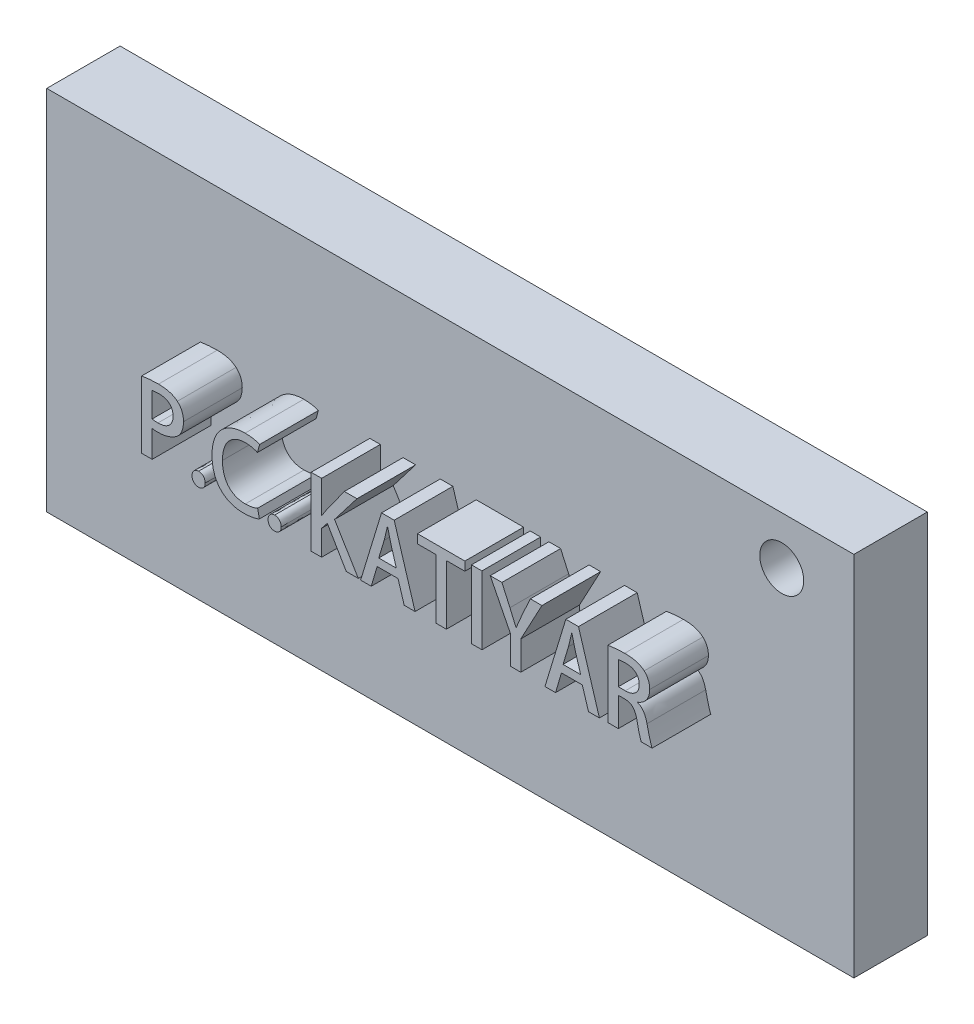
from build123d import *

# Parameters (mm, degrees)
SKETCH1_W           = 55
SKETCH1_H           = 25
BOSS_EXTRUDE1_DEPTH = 5
SKETCH3_W           = 0.714515982
SKETCH3_H           = 4.656666667
BOSS_EXTRUDE4_DEPTH = 4
SKETCH6_R           = 1.5
CUT_EXTRUDE1_DEPTH  = 7


with BuildPart() as part:
    # Sketch1 → Boss-Extrude1 (new body)
    with BuildSketch(Plane.XY):
        Rectangle(SKETCH1_W, SKETCH1_H)
    extrude(amount=BOSS_EXTRUDE1_DEPTH)

    # Sketch3 → Boss-Extrude4 (add)
    # profile 1 of 11: a face of its own
    with BuildSketch(Plane.XY.offset(5)):
        with BuildLine():
            Line((-17.029770283, -1.800414913), (-16.315254301, -1.800414913))
            Line((-16.315254301, -1.800414913), (-16.315254301, 0.023936519))
            add(Edge.make_bspline(
                [(-16.315254301, 0.023936519), (-16.285392815, 0.018639375), (-16.223879003, 0.007727408), (-16.127983148, -0.001163949), (-16.026409437, -0.006734384), (-15.956832168, -0.006633939), (-15.92103906, -0.006582267)],
                knots=[0, 0, 0, 0, 0.918571729, 1.892231672, 2.915686383, 4, 4, 4, 4], degree=3))
            add(Edge.make_bspline(
                [(-15.92103906, -0.006582267), (-15.866743001, -0.006552611), (-15.759417019, -0.006493991), (-15.600654275, 0.00838968), (-15.445883638, 0.032684173), (-15.295180159, 0.068728451), (-15.148615385, 0.116740488), (-15.00587218, 0.174712233), (-14.86725815, 0.243691045), (-14.733599907, 0.322766035), (-14.60882504, 0.415295917), (-14.498440162, 0.524531899), (-14.40492606, 0.649747113), (-14.32675556, 0.789759899), (-14.264511341, 0.944457167), (-14.218028562, 1.114204168), (-14.187055863, 1.298806239), (-14.17983852, 1.427312507), (-14.176108655, 1.493723503)],
                knots=[0, 0, 0, 0, 1.002223409, 1.981075816, 2.941057117, 3.893567037, 4.839120738, 5.786658294, 6.736252809, 7.695867274, 8.651375827, 9.597441389, 10.552949943, 11.527852714, 12.550822771, 13.624507394, 14.772364707, 16, 16, 16, 16], degree=3))
            add(Edge.make_bspline(
                [(-14.176108655, 1.493723503), (-14.1783963, 1.54571858), (-14.182862192, 1.647222294), (-14.20512132, 1.79455995), (-14.239374517, 1.93282038), (-14.285851746, 2.062359991), (-14.3460668, 2.182243262), (-14.417887871, 2.293527018), (-14.502339657, 2.395656094), (-14.56807978, 2.454809629), (-14.601121961, 2.484541272)],
                knots=[0, 0, 0, 0, 1.121960372, 2.190267843, 3.207584746, 4.190239261, 5.152208329, 6.094546313, 7.042284316, 8, 8, 8, 8], degree=3))
            add(Edge.make_bspline(
                [(-14.601121961, 2.484541272), (-14.638282312, 2.514526794), (-14.713772144, 2.575441239), (-14.842300797, 2.650812914), (-14.983447027, 2.714750069), (-15.137715933, 2.767890995), (-15.305708989, 2.808121189), (-15.487121676, 2.835074112), (-15.681602848, 2.853664121), (-15.815691527, 2.855123855), (-15.884961326, 2.855877949)],
                knots=[0, 0, 0, 0, 0.838628006, 1.70364077, 2.610636308, 3.559859354, 4.568055018, 5.643200099, 6.782484425, 8, 8, 8, 8], degree=3))
            add(Edge.make_bspline(
                [(-15.884961326, 2.855877949), (-15.943333683, 2.854829794), (-16.057161841, 2.852785856), (-16.223213823, 2.847720828), (-16.380179001, 2.839929349), (-16.527994713, 2.829119118), (-16.666832774, 2.817260546), (-16.796528172, 2.802275236), (-16.916835617, 2.7848931), (-16.993726229, 2.771023788), (-17.030649368, 2.764363697)],
                knots=[0, 0, 0, 0, 1.217605855, 2.374374404, 3.464660226, 4.494999595, 5.465333604, 6.370582827, 7.217548217, 8, 8, 8, 8], degree=3))
            Line((-17.030649368, 2.764363697), (-17.029770283, -1.800414913))
        make_face()
        with BuildLine():
            add(Edge.make_bspline(
                [(-16.315254301, 2.260822198), (-16.287740393, 2.266242775), (-16.225444409, 2.278515847), (-16.11894681, 2.28978789), (-15.988917885, 2.298409045), (-15.894071527, 2.300993532), (-15.842723979, 2.302392712)],
                knots=[0, 0, 0, 0, 0.7081459, 1.603358068, 2.702515415, 4, 4, 4, 4], degree=3))
            add(Edge.make_bspline(
                [(-15.842723979, 2.302392712), (-15.807799407, 2.301663325), (-15.739573213, 2.300238447), (-15.639808614, 2.290691735), (-15.54542675, 2.273891015), (-15.456276344, 2.251023722), (-15.372304007, 2.222427452), (-15.294087857, 2.185734236), (-15.221152695, 2.142914183), (-15.153999828, 2.09330162), (-15.09260626, 2.038093463), (-15.039769552, 1.975063555), (-14.994275989, 1.905792115), (-14.957461766, 1.829656531), (-14.928351051, 1.747300297), (-14.907337063, 1.658519729), (-14.894028355, 1.563337439), (-14.891779103, 1.497581044), (-14.890623778, 1.463805382)],
                knots=[0, 0, 0, 0, 1.16517395, 2.276202082, 3.339667925, 4.360262278, 5.344409501, 6.294443781, 7.237649562, 8.161467064, 9.075802852, 9.985465996, 10.897442204, 11.83402534, 12.799705885, 13.806079676, 14.873096483, 16, 16, 16, 16], degree=3))
            add(Edge.make_bspline(
                [(-14.890623778, 1.463805382), (-14.891804611, 1.427983886), (-14.894106598, 1.358151308), (-14.907119249, 1.25671211), (-14.929285884, 1.161883545), (-14.959234619, 1.073415289), (-14.996817491, 0.990952124), (-15.04403857, 0.915391587), (-15.099906969, 0.846577936), (-15.163425629, 0.783729672), (-15.234746969, 0.72839274), (-15.313289756, 0.680728184), (-15.3978016, 0.638984096), (-15.489647578, 0.605708611), (-15.588229024, 0.580638761), (-15.693068382, 0.560896462), (-15.804942769, 0.549750203), (-15.881711729, 0.547867463), (-15.92103906, 0.54690297)],
                knots=[0, 0, 0, 0, 1.098810706, 2.142087657, 3.130558938, 4.080710143, 5.002414742, 5.90351999, 6.805477983, 7.715119197, 8.638227497, 9.567016518, 10.528554789, 11.524610674, 12.556657526, 13.645294696, 14.7937276, 16, 16, 16, 16], degree=3))
            add(Edge.make_bspline(
                [(-15.92103906, 0.54690297), (-15.959475635, 0.546770606), (-16.032887214, 0.546517798), (-16.137149196, 0.552786407), (-16.230653249, 0.563087425), (-16.288070832, 0.576588723), (-16.315254301, 0.582980704)],
                knots=[0, 0, 0, 0, 1.161542367, 2.218477041, 3.156565424, 4, 4, 4, 4], degree=3))
            Line((-16.315254301, 0.582980704), (-16.315254301, 2.260822198))
        make_face(mode=Mode.SUBTRACT)
    # profile 2 of 11: a face of its own
    with BuildSketch(Plane.XY.offset(5)):
        with BuildLine():
            add(Edge.make_bspline(
                [(-13.155704463, -1.865905487), (-13.122534719, -1.864017984), (-13.059060567, -1.860406027), (-12.970000993, -1.833739906), (-12.890981162, -1.793350651), (-12.825927069, -1.734642907), (-12.772241754, -1.664855291), (-12.734283044, -1.583103764), (-12.711053717, -1.491715865), (-12.707542355, -1.427542114), (-12.705721007, -1.394255111)],
                knots=[0, 0, 0, 0, 1.086321549, 2.078802294, 3.02560671, 3.973192882, 4.927592108, 5.895903821, 6.908602731, 8, 8, 8, 8], degree=3))
            add(Edge.make_bspline(
                [(-12.705721007, -1.394255111), (-12.707430475, -1.360067406), (-12.710717526, -1.294329574), (-12.735225644, -1.201403443), (-12.773093001, -1.118466626), (-12.826477343, -1.047682222), (-12.891989322, -0.98944608), (-12.969426945, -0.947673006), (-13.056630024, -0.921317721), (-13.118222758, -0.917526759), (-13.150093097, -0.915565176)],
                knots=[0, 0, 0, 0, 1.119884095, 2.153369304, 3.130156156, 4.09200604, 5.039367142, 5.9820291, 6.955827887, 8, 8, 8, 8], degree=3))
            add(Edge.make_bspline(
                [(-13.150093097, -0.915565176), (-13.181661374, -0.917898254), (-13.24263235, -0.922404361), (-13.329699727, -0.94868924), (-13.407394138, -0.991512808), (-13.474629439, -1.050197595), (-13.529100913, -1.121596096), (-13.569619302, -1.203657558), (-13.594614201, -1.295750399), (-13.598574779, -1.36065834), (-13.6006248, -1.394255111)],
                knots=[0, 0, 0, 0, 1.034342518, 1.997729303, 2.952262481, 3.919234818, 4.899147778, 5.87438783, 6.899769402, 8, 8, 8, 8], degree=3))
            add(Edge.make_bspline(
                [(-13.6006248, -1.394255111), (-13.598699766, -1.426640017), (-13.594978249, -1.489247202), (-13.572965504, -1.578998633), (-13.535280444, -1.659478875), (-13.484191921, -1.730521313), (-13.419563724, -1.789519294), (-13.341807881, -1.832383059), (-13.252705328, -1.859413548), (-13.189302928, -1.863680975), (-13.155704463, -1.865905487)],
                knots=[0, 0, 0, 0, 1.071520527, 2.071486102, 3.03497588, 3.993569347, 4.948276975, 5.903723635, 6.907259185, 8, 8, 8, 8], degree=3))
        make_face()
    # profile 3 of 11: a face of its own
    with BuildSketch(Plane.XY.offset(5)):
        with BuildLine():
            add(Edge.make_bspline(
                [(-9.131938905, -1.093733361), (-9.159157803, -1.106034189), (-9.215301949, -1.131406983), (-9.305933693, -1.162626679), (-9.404263472, -1.190870151), (-9.547653614, -1.222221287), (-9.737451826, -1.251363711), (-9.892703174, -1.25625417), (-9.971732722, -1.258743622)],
                knots=[0, 0, 0, 0, 0.623452072, 1.285988292, 1.999456477, 2.758826813, 4.350104822, 6, 6, 6, 6], degree=3))
            add(Edge.make_bspline(
                [(-9.971732722, -1.258743622), (-10.030757036, -1.257152592), (-10.146000059, -1.254046159), (-10.314038601, -1.23187746), (-10.472063951, -1.195101249), (-10.620179439, -1.143872769), (-10.758390365, -1.078526848), (-10.886743354, -0.998765087), (-11.00571035, -0.905178637), (-11.112945256, -0.796013523), (-11.210210487, -0.674740787), (-11.294129837, -0.539533314), (-11.365529239, -0.392095512), (-11.423476868, -0.231529987), (-11.468982696, -0.058615258), (-11.501933268, 0.126780591), (-11.523650707, 0.324652519), (-11.526755923, 0.46090217), (-11.528354954, 0.531063965)],
                knots=[0, 0, 0, 0, 1.05357022, 2.05706105, 3.019831997, 3.945549259, 4.849673394, 5.743319306, 6.637992512, 7.545159443, 8.469260999, 9.40786221, 10.379774602, 11.388606811, 12.450446757, 13.567948197, 14.747614263, 16, 16, 16, 16], degree=3))
            add(Edge.make_bspline(
                [(-11.528354954, 0.531063965), (-11.526166632, 0.604751385), (-11.521918957, 0.747783424), (-11.498635244, 0.955086166), (-11.46350963, 1.148700658), (-11.412882517, 1.327391767), (-11.351755875, 1.492996828), (-11.276073052, 1.643915875), (-11.186710456, 1.780725044), (-11.084170324, 1.902450401), (-10.971205808, 2.009385555), (-10.851172206, 2.104086622), (-10.721692972, 2.182425465), (-10.584584447, 2.247093942), (-10.439404683, 2.297318008), (-10.286463598, 2.33347456), (-10.125449103, 2.354818456), (-10.015501171, 2.35739487), (-9.959413496, 2.358709175)],
                knots=[0, 0, 0, 0, 1.299388365, 2.522196691, 3.674517046, 4.765011746, 5.792850895, 6.78279016, 7.735273338, 8.667647605, 9.582179065, 10.473965087, 11.358296398, 12.244395391, 13.142353843, 14.061873137, 15.011304445, 16, 16, 16, 16], degree=3))
            add(Edge.make_bspline(
                [(-9.959413496, 2.358709175), (-9.917155418, 2.358011455), (-9.834872038, 2.356652882), (-9.71501542, 2.346766753), (-9.602079428, 2.331395071), (-9.496621671, 2.308759704), (-9.397804766, 2.283710637), (-9.306791856, 2.254275322), (-9.222210704, 2.224250994), (-9.169936989, 2.199839344), (-9.144584673, 2.187999897)],
                knots=[0, 0, 0, 0, 1.208363836, 2.352881735, 3.437133088, 4.465326887, 5.435785295, 6.351019915, 7.200258411, 8, 8, 8, 8], degree=3))
            Line((-9.144584673, 2.187999897), (-8.992046597, 2.741441308))
            add(Edge.make_bspline(
                [(-8.992046597, 2.741441308), (-9.011096668, 2.750245634), (-9.054748778, 2.770420225), (-9.131463002, 2.796897745), (-9.227105541, 2.823675944), (-9.340972184, 2.852080447), (-9.474409717, 2.877897793), (-9.627262683, 2.896521629), (-9.799365001, 2.908800826), (-9.920379667, 2.911024446), (-9.984051948, 2.912194412)],
                knots=[0, 0, 0, 0, 0.496702161, 1.138163611, 1.91855369, 2.848405013, 3.916323618, 5.1344412, 6.492276418, 8, 8, 8, 8], degree=3))
            add(Edge.make_bspline(
                [(-9.984051948, 2.912194412), (-10.064511507, 2.910420937), (-10.222161203, 2.90694605), (-10.453081316, 2.877145188), (-10.672554054, 2.829099901), (-10.881107136, 2.762039266), (-11.07794504, 2.675429866), (-11.264025025, 2.570366085), (-11.438163665, 2.445372024), (-11.600314731, 2.302024915), (-11.747680438, 2.139985904), (-11.877396971, 1.959058358), (-11.986378186, 1.758978683), (-12.076075154, 1.541040559), (-12.147441582, 1.305277153), (-12.199607981, 1.05141648), (-12.233281152, 0.779180987), (-12.240191617, 0.591585017), (-12.243750022, 0.494986231)],
                knots=[0, 0, 0, 0, 1.03290171, 2.023832137, 2.984342952, 3.914651939, 4.832153672, 5.741329135, 6.653845778, 7.579752141, 8.515717201, 9.460636037, 10.431621588, 11.434718984, 12.482079593, 13.59017517, 14.759108983, 16, 16, 16, 16], degree=3))
            add(Edge.make_bspline(
                [(-12.243750022, 0.494986231), (-12.241414793, 0.403669219), (-12.236874113, 0.226110102), (-12.205713476, -0.032015814), (-12.16038968, -0.274203387), (-12.095796057, -0.500430249), (-12.01412909, -0.710306631), (-11.915494897, -0.904986272), (-11.797584502, -1.082437159), (-11.663836261, -1.244325156), (-11.513717726, -1.387505534), (-11.351164883, -1.513746234), (-11.17496348, -1.619666152), (-10.985979375, -1.706345208), (-10.784171701, -1.774121335), (-10.569355445, -1.82326882), (-10.341563504, -1.853416094), (-10.185358467, -1.858186508), (-10.105484321, -1.860625819)],
                knots=[0, 0, 0, 0, 1.218192015, 2.368683481, 3.46472865, 4.502784375, 5.502806439, 6.46546417, 7.408714485, 8.339731523, 9.261456675, 10.171063186, 11.080509719, 11.998104615, 12.939916794, 13.915847741, 14.934286092, 16, 16, 16, 16], degree=3))
            add(Edge.make_bspline(
                [(-10.105484321, -1.860625819), (-10.043860708, -1.859830601), (-9.924884137, -1.858295276), (-9.752607475, -1.845167267), (-9.592723805, -1.827586374), (-9.445883565, -1.80213469), (-9.314024365, -1.771183113), (-9.197483163, -1.739200963), (-9.09748154, -1.704809048), (-9.038216318, -1.677169076), (-9.010833074, -1.664398144)],
                knots=[0, 0, 0, 0, 1.319898282, 2.548324642, 3.699499855, 4.764539851, 5.738494737, 6.599877469, 7.353079316, 8, 8, 8, 8], degree=3))
            Line((-9.010833074, -1.664398144), (-9.131938905, -1.093733361))
        make_face()
    # profile 4 of 11: a face of its own
    with BuildSketch(Plane.XY.offset(5)):
        with BuildLine():
            add(Edge.make_bspline(
                [(-7.974589876, -1.865905487), (-7.941420133, -1.864017984), (-7.87794598, -1.860406027), (-7.788886406, -1.833739906), (-7.709866575, -1.793350651), (-7.644812482, -1.734642907), (-7.591127167, -1.664855291), (-7.553168457, -1.583103764), (-7.52993913, -1.491715865), (-7.526427768, -1.427542114), (-7.52460642, -1.394255111)],
                knots=[0, 0, 0, 0, 1.086321549, 2.078802294, 3.02560671, 3.973192882, 4.927592108, 5.895903821, 6.908602731, 8, 8, 8, 8], degree=3))
            add(Edge.make_bspline(
                [(-7.52460642, -1.394255111), (-7.526315888, -1.360067406), (-7.52960294, -1.294329574), (-7.554111057, -1.201403443), (-7.591978414, -1.118466626), (-7.645362756, -1.047682222), (-7.710874735, -0.98944608), (-7.788312358, -0.947673006), (-7.875515437, -0.921317721), (-7.937108172, -0.917526759), (-7.96897851, -0.915565176)],
                knots=[0, 0, 0, 0, 1.119884095, 2.153369304, 3.130156156, 4.09200604, 5.039367142, 5.9820291, 6.955827887, 8, 8, 8, 8], degree=3))
            add(Edge.make_bspline(
                [(-7.96897851, -0.915565176), (-8.000546787, -0.917898254), (-8.061517763, -0.922404361), (-8.148585141, -0.94868924), (-8.226279551, -0.991512808), (-8.293514853, -1.050197595), (-8.347986326, -1.121596096), (-8.388504715, -1.203657558), (-8.413499615, -1.295750399), (-8.417460193, -1.36065834), (-8.419510213, -1.394255111)],
                knots=[0, 0, 0, 0, 1.034342518, 1.997729303, 2.952262481, 3.919234818, 4.899147778, 5.87438783, 6.899769402, 8, 8, 8, 8], degree=3))
            add(Edge.make_bspline(
                [(-8.419510213, -1.394255111), (-8.417585179, -1.426640017), (-8.413863662, -1.489247202), (-8.391850918, -1.578998633), (-8.354165858, -1.659478875), (-8.303077334, -1.730521313), (-8.238449138, -1.789519294), (-8.160693294, -1.832383059), (-8.071590742, -1.859413548), (-8.008188341, -1.863680975), (-7.974589876, -1.865905487)],
                knots=[0, 0, 0, 0, 1.071520527, 2.071486102, 3.03497588, 3.993569347, 4.948276975, 5.903723635, 6.907259185, 8, 8, 8, 8], degree=3))
        make_face()
    # profile 5 of 11: a face of its own
    with BuildSketch(Plane.XY.offset(5)):
        with BuildLine():
            Line((-3.888449642, 0.868072486), (-2.361798808, 2.852357311))
            Line((-2.361798808, 2.852357311), (-3.219399476, 2.852357311))
            Line((-3.219399476, 2.852357311), (-4.417607501, 1.184618854))
            add(Edge.make_bspline(
                [(-4.417607501, 1.184618854), (-4.474140223, 1.100867224), (-4.589230171, 0.930364718), (-4.697628136, 0.755530357), (-4.752780512, 0.666575454)],
                knots=[0, 0, 0, 0, 0.982409385, 2, 2, 2, 2], degree=3))
            Line((-4.752780512, 0.666575454), (-4.770379406, 0.66718729))
            Line((-4.770379406, 0.66718729), (-4.770379406, 2.852357311))
            Line((-4.770379406, 2.852357311), (-5.484895389, 2.852357311))
            Line((-5.484895389, 2.852357311), (-5.484895389, -1.804309356))
            Line((-5.484895389, -1.804309356), (-4.770379406, -1.804309356))
            Line((-4.770379406, -1.804309356), (-4.770379406, -0.09374148))
            Line((-4.770379406, -0.09374148), (-4.381113855, 0.393252933))
            Line((-4.381113855, 0.393252933), (-3.091671717, -1.804309356))
            Line((-3.091671717, -1.804309356), (-2.270564695, -1.804309356))
            Line((-2.270564695, -1.804309356), (-3.888449642, 0.868072486))
        make_face()
    # profile 6 of 11: a face of its own
    with BuildSketch(Plane.XY.offset(5)):
        Polygon((0.17560862, 2.855529065), (-0.687952298, 2.855529065), (-2.111187283, -1.82518742), (-1.387315013, -1.82518742), (-0.985941629, -0.456675716), (0.437109461, -0.456675716), (0.856727091, -1.82518742), (1.59865971, -1.82518742), align=None)
        with BuildLine():
            Line((-0.876476161, 0.096811239), (-0.505509851, 1.328329984))
            add(Edge.make_bspline(
                [(-0.505509851, 1.328329984), (-0.485669277, 1.40301166), (-0.445166767, 1.5554667), (-0.391727466, 1.787483883), (-0.338866773, 2.01902388), (-0.304061607, 2.172157798), (-0.287060993, 2.246956194)],
                knots=[0, 0, 0, 0, 0.981880665, 2.004409445, 3.025252049, 4, 4, 4, 4], degree=3))
            Line((-0.287060993, 2.246956194), (-0.274416084, 2.247301641))
            add(Edge.make_bspline(
                [(-0.274416084, 2.247301641), (-0.257363487, 2.172943917), (-0.222436649, 2.020645697), (-0.166620647, 1.789947674), (-0.107513608, 1.555749102), (-0.06524715, 1.399803389), (-0.044196246, 1.32213428)],
                knots=[0, 0, 0, 0, 0.960134074, 1.966530216, 2.987225846, 4, 4, 4, 4], degree=3))
            Line((-0.044196246, 1.32213428), (0.321562578, 0.096811239))
            Line((0.321562578, 0.096811239), (-0.876476161, 0.096811239))
        make_face(mode=Mode.SUBTRACT)
    # profile 7 of 11: a face of its own
    with BuildSketch(Plane.XY.offset(5)):
        Polygon((4.992437259, 2.852487927), (1.765942016, 2.852487927), (1.765942016, 2.250342778), (3.018890509, 2.250342778), (3.018890509, -1.800451864), (3.733406491, -1.800451864), (3.733406491, 2.250342778), (4.992437259, 2.250342778), align=None)
    # profile 8 of 11: a face of its own
    with BuildSketch(Plane.XY.offset(5)):
        with Locations((5.797756405, 0.524023977)):
            Rectangle(SKETCH3_W, SKETCH3_H)
    # profile 9 of 11: a face of its own
    with BuildSketch(Plane.XY.offset(5)):
        with BuildLine():
            Line((9.452691496, 2.852357311), (8.89920454, 1.641176116))
            add(Edge.make_bspline(
                [(8.89920454, 1.641176116), (8.861338824, 1.556893338), (8.787028369, 1.391490639), (8.67982518, 1.146159222), (8.58075318, 0.907503713), (8.518340815, 0.749959285), (8.487747883, 0.672735067)],
                knots=[0, 0, 0, 0, 1.053617633, 2.067696443, 3.052834596, 4, 4, 4, 4], degree=3))
            Line((8.487747883, 0.672735067), (8.475428657, 0.67327472))
            add(Edge.make_bspline(
                [(8.475428657, 0.67327472), (8.444272532, 0.753676163), (8.382344748, 0.913486895), (8.279679538, 1.150558832), (8.173431617, 1.390627993), (8.10011798, 1.552151901), (8.062734577, 1.63451466)],
                knots=[0, 0, 0, 0, 0.988875599, 1.96554849, 2.962611543, 4, 4, 4, 4], degree=3))
            Line((8.062734577, 1.63451466), (7.515638392, 2.852357311))
            Line((7.515638392, 2.852357311), (6.718860467, 2.852357311))
            Line((6.718860467, 2.852357311), (8.08737217, 0.143668296))
            Line((8.08737217, 0.143668296), (8.08737217, -1.804309356))
            Line((8.08737217, -1.804309356), (8.801888152, -1.804309356))
            Line((8.801888152, -1.804309356), (8.801888152, 0.161930587))
            Line((8.801888152, 0.161930587), (10.243387147, 2.852357311))
            Line((10.243387147, 2.852357311), (9.452691496, 2.852357311))
        make_face()
    # profile 10 of 11: a face of its own
    with BuildSketch(Plane.XY.offset(5)):
        Polygon((12.734179847, 2.855529065), (11.870618928, 2.855529065), (10.447383943, -1.82518742), (11.171256213, -1.82518742), (11.572629598, -0.456675716), (12.995680688, -0.456675716), (13.415298317, -1.82518742), (14.157230937, -1.82518742), align=None)
        with BuildLine():
            Line((11.682095066, 0.096811239), (12.053061376, 1.328329984))
            add(Edge.make_bspline(
                [(12.053061376, 1.328329984), (12.072901949, 1.40301166), (12.11340446, 1.5554667), (12.16684376, 1.787483883), (12.219704453, 2.01902388), (12.25450962, 2.172157798), (12.271510234, 2.246956194)],
                knots=[0, 0, 0, 0, 0.981880665, 2.004409445, 3.025252049, 4, 4, 4, 4], degree=3))
            Line((12.271510234, 2.246956194), (12.284155143, 2.247301641))
            add(Edge.make_bspline(
                [(12.284155143, 2.247301641), (12.30120774, 2.172943917), (12.336134577, 2.020645697), (12.39195058, 1.789947674), (12.451057619, 1.555749102), (12.493324077, 1.399803389), (12.51437498, 1.32213428)],
                knots=[0, 0, 0, 0, 0.960134074, 1.966530216, 2.987225846, 4, 4, 4, 4], degree=3))
            Line((12.51437498, 1.32213428), (12.880133805, 0.096811239))
            Line((12.880133805, 0.096811239), (11.682095066, 0.096811239))
        make_face(mode=Mode.SUBTRACT)
    # profile 11 of 11: a face of its own
    with BuildSketch(Plane.XY.offset(5)):
        with BuildLine():
            add(Edge.make_bspline(
                [(16.744813261, 0.402757883), (16.774445373, 0.413688338), (16.833269052, 0.435386744), (16.91759954, 0.475709392), (16.99924642, 0.519416512), (17.076404308, 0.569384693), (17.148977338, 0.625456858), (17.217762973, 0.686313497), (17.282968044, 0.75225897), (17.343752352, 0.823570062), (17.399256989, 0.899782368), (17.447635801, 0.981144838), (17.489926212, 1.067013005), (17.52217168, 1.158675541), (17.550588061, 1.254137403), (17.568833077, 1.354806259), (17.583102018, 1.459896336), (17.585269616, 1.531802547), (17.58637642, 1.568518805)],
                knots=[0, 0, 0, 0, 0.984448908, 1.954261881, 2.912051287, 3.871106542, 4.816984922, 5.769562366, 6.733317195, 7.706618018, 8.689159246, 9.669611908, 10.655553532, 11.668369991, 12.696152468, 13.758167005, 14.855290571, 16, 16, 16, 16], degree=3))
            add(Edge.make_bspline(
                [(17.58637642, 1.568518805), (17.585291574, 1.61552213), (17.583167329, 1.707559681), (17.563697697, 1.841437716), (17.53554052, 1.968231156), (17.493781462, 2.086767927), (17.440584557, 2.197661665), (17.376198911, 2.30134011), (17.299427166, 2.396915573), (17.240329325, 2.453483232), (17.210640019, 2.481901437)],
                knots=[0, 0, 0, 0, 1.106785191, 2.167204112, 3.181420928, 4.162778401, 5.120989717, 6.07402843, 7.032439092, 8, 8, 8, 8], degree=3))
            add(Edge.make_bspline(
                [(17.210640019, 2.481901437), (17.172992296, 2.512907721), (17.096611007, 2.575814576), (16.964720199, 2.65170797), (16.819838852, 2.717167732), (16.659940777, 2.769757021), (16.485348945, 2.808668339), (16.296578101, 2.836651681), (16.092802345, 2.852536895), (15.952053756, 2.852999129), (15.879283638, 2.853238115)],
                knots=[0, 0, 0, 0, 0.827221313, 1.678301493, 2.574754406, 3.524835391, 4.531659668, 5.609758117, 6.764192347, 8, 8, 8, 8], degree=3))
            add(Edge.make_bspline(
                [(15.879283638, 2.853238115), (15.774837846, 2.851446343), (15.56898124, 2.847914865), (15.314845111, 2.831329951), (15.120108654, 2.810534294), (14.983254936, 2.795324729), (14.854781922, 2.77676209), (14.771990568, 2.762487572), (14.731835707, 2.755564249)],
                knots=[0, 0, 0, 0, 1.630788357, 3.214189375, 3.973790731, 4.688368382, 5.363841967, 6, 6, 6, 6], degree=3))
            Line((14.731835707, 2.755564249), (14.732714792, -1.809170535))
            Line((14.732714792, -1.809170535), (15.447230774, -1.809170535))
            Line((15.447230774, -1.809170535), (15.447230774, 0.161486318))
            Line((15.447230774, 0.161486318), (15.873696333, 0.161486318))
            add(Edge.make_bspline(
                [(15.873696333, 0.161486318), (15.903158973, 0.161111227), (15.960363354, 0.160382954), (16.043631624, 0.150963323), (16.122165526, 0.137624943), (16.195510455, 0.116703254), (16.263021502, 0.087863451), (16.325714922, 0.054054034), (16.382548968, 0.012679644), (16.435390886, -0.034217569), (16.482965756, -0.089636739), (16.527045231, -0.152467705), (16.567500617, -0.223240088), (16.604378156, -0.30227423), (16.638588773, -0.389220907), (16.66922279, -0.484488635), (16.696372945, -0.587687044), (16.711713911, -0.659433202), (16.719630858, -0.696458937)],
                knots=[0, 0, 0, 0, 1.05460192, 2.04760499, 2.997500883, 3.905099692, 4.771330184, 5.622266628, 6.450198754, 7.283312565, 8.146991563, 9.059198733, 10.028584943, 11.062366604, 12.180106072, 13.372689096, 14.644134814, 16, 16, 16, 16], degree=3))
            add(Edge.make_bspline(
                [(16.719630858, -0.696458937), (16.733769927, -0.765438231), (16.760884142, -0.897718467), (16.803494059, -1.086773395), (16.843282167, -1.258329924), (16.882994097, -1.410702542), (16.919253132, -1.542555752), (16.952720151, -1.652365924), (16.982220001, -1.739441988), (17.004156072, -1.788583877), (17.013532399, -1.809589024)],
                knots=[0, 0, 0, 0, 1.465707569, 2.810758609, 4.034056387, 5.131408685, 6.088374617, 6.88023951, 7.521370969, 8, 8, 8, 8], degree=3))
            Line((17.013532399, -1.809589024), (17.75147691, -1.809170535))
            add(Edge.make_bspline(
                [(17.75147691, -1.809170535), (17.739142639, -1.782495694), (17.71110701, -1.721864146), (17.674873207, -1.615501385), (17.634258649, -1.485648121), (17.593240482, -1.332343078), (17.548401999, -1.159346949), (17.502581082, -0.968338062), (17.451751835, -0.761852924), (17.41870404, -0.618482484), (17.401588026, -0.544228499)],
                knots=[0, 0, 0, 0, 0.536382744, 1.219190635, 2.049369578, 3.02138797, 4.116602825, 5.313141612, 6.608430422, 8, 8, 8, 8], degree=3))
            add(Edge.make_bspline(
                [(17.401588026, -0.544228499), (17.387710059, -0.484969139), (17.360942846, -0.37067229), (17.304770037, -0.21022995), (17.241042144, -0.06569649), (17.167356964, 0.062437755), (17.081457416, 0.173610264), (16.981886512, 0.265886355), (16.869665617, 0.341307604), (16.786354833, 0.374423718), (16.744269311, 0.391152752)],
                knots=[0, 0, 0, 0, 1.21940983, 2.351944079, 3.402180539, 4.382494675, 5.308257689, 6.20701365, 7.094249724, 8, 8, 8, 8], degree=3))
            Line((16.744269311, 0.391152752), (16.744813261, 0.402757883))
        make_face()
        with BuildLine():
            Line((15.447230774, 0.661295785), (15.447230774, 2.263193924))
            add(Edge.make_bspline(
                [(15.447230774, 2.263193924), (15.459511733, 2.26645647), (15.485921487, 2.273472457), (15.529800391, 2.281081042), (15.580587179, 2.287946692), (15.638657628, 2.294276373), (15.703852172, 2.298263715), (15.776304526, 2.301788699), (15.855797388, 2.304620122), (15.91125225, 2.30489174), (15.939999825, 2.305032546)],
                knots=[0, 0, 0, 0, 0.614934877, 1.322395026, 2.153817003, 3.09630114, 4.149527974, 5.315346739, 6.6082867, 8, 8, 8, 8], degree=3))
            add(Edge.make_bspline(
                [(15.939999825, 2.305032546), (15.971982963, 2.304825483), (16.034567123, 2.304420304), (16.126616868, 2.297396238), (16.214599873, 2.284383589), (16.298746306, 2.264921554), (16.379136411, 2.239427809), (16.455538246, 2.207669614), (16.528227027, 2.170773927), (16.596249758, 2.127540577), (16.659598813, 2.077839691), (16.713976777, 2.018172424), (16.761460432, 1.951351408), (16.800498445, 1.875904205), (16.829457488, 1.791741464), (16.853093886, 1.700383023), (16.866458208, 1.600554079), (16.870019416, 1.531301355), (16.871861297, 1.495483392)],
                knots=[0, 0, 0, 0, 1.091256665, 2.135355867, 3.147538717, 4.123639677, 5.079671503, 6.022139661, 6.944350032, 7.857936834, 8.76932751, 9.683078809, 10.602350983, 11.560424328, 12.570427029, 13.633781589, 14.776176296, 16, 16, 16, 16], degree=3))
            add(Edge.make_bspline(
                [(16.871861297, 1.495483392), (16.870609856, 1.464648181), (16.868156904, 1.404207997), (16.855940974, 1.31602405), (16.835596269, 1.232590928), (16.8075993, 1.153965649), (16.771195817, 1.080674666), (16.7277355, 1.01208197), (16.676244499, 0.948458792), (16.617445802, 0.889538617), (16.551337427, 0.836710026), (16.478917477, 0.790916224), (16.400641667, 0.752143482), (16.3169865, 0.719094073), (16.226475479, 0.695035059), (16.130318596, 0.676727625), (16.02833418, 0.663780132), (15.958226515, 0.662135967), (15.92240093, 0.661295785)],
                knots=[0, 0, 0, 0, 1.040171501, 2.038843028, 2.995952568, 3.931353777, 4.846937716, 5.749610306, 6.664018294, 7.601143361, 8.551071914, 9.51139538, 10.484468404, 11.492790098, 12.538916067, 13.636779592, 14.792375232, 16, 16, 16, 16], degree=3))
            Line((15.92240093, 0.661295785), (15.447230774, 0.661295785))
        make_face(mode=Mode.SUBTRACT)
    extrude(amount=BOSS_EXTRUDE4_DEPTH)

    # Sketch6 → Cut-Extrude1 (cut)
    with BuildSketch(Plane.XY.offset(5)):
        with Locations((22.583948506, 9.23397797)):
            Circle(SKETCH6_R)
    extrude(amount=-CUT_EXTRUDE1_DEPTH, mode=Mode.SUBTRACT)


solid = part.part
